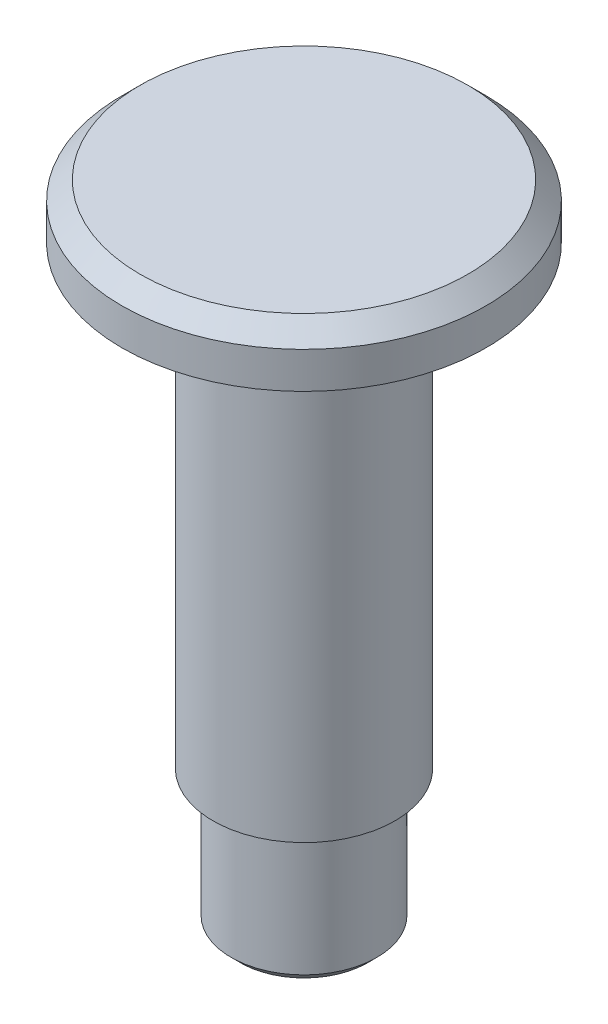
from build123d import *


with BuildPart() as part:
    # Esquisse1 → Base-Révolution (revolve)
    with BuildSketch(Plane.XY, mode=Mode.PRIVATE) as base_r_volution_sk:
        with BuildLine():
            Line((0, 0), (3.5, 0))
            Line((3.5, 0), (4, 0.5))
            Line((4, 0.5), (4, 7.5))
            ThreePointArc((4, 7.5), (4.3, 7.8), (4.6, 7.5))
            Line((4.6, 7.5), (5, 7.5))
            Line((5, 7.5), (5, 32.5))
            ThreePointArc((5, 32.5), (5.3, 32.8), (5.6, 32.5))
            Line((5.6, 32.5), (10, 32.5))
            Line((10, 32.5), (10, 34.5))
            Line((10, 34.5), (9, 35.5))
            Line((9, 35.5), (0, 35.5))
            Line((0, 35.5), (0, 0))
        make_face()
    revolve(base_r_volution_sk.sketch.rotate(Axis((0, 0, 0), (0, 1, 0)), 90), axis=Axis((0, 0, 0), (0, 1, 0)))


solid = part.part
